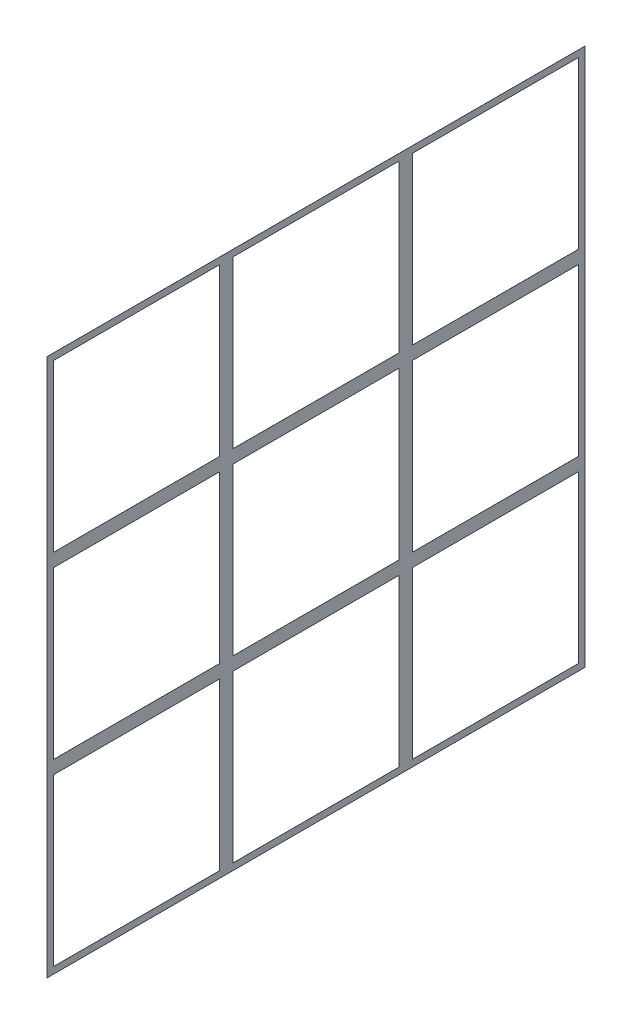
from build123d import *

# Parameters (mm, degrees)
SKETCH_1_W      = 1620
SKETCH_1_H      = 1620
SKETCH_1_W_2    = 500
SKETCH_1_H_2    = 500
EXTRUDE_1_DEPTH = 0.1


with BuildPart() as part:
    # 草图1 → 凸台-拉伸1 (new body)
    with BuildSketch(Plane(origin=(0, 0, 0), x_dir=(0, 0, -1), z_dir=(1, 0, 0))):
        Rectangle(SKETCH_1_W, SKETCH_1_H)
        with Locations((-540, 540)):
            Rectangle(SKETCH_1_W_2, SKETCH_1_H_2, mode=Mode.SUBTRACT)
        with Locations((0, 540)):
            Rectangle(SKETCH_1_W_2, SKETCH_1_H_2, mode=Mode.SUBTRACT)
        with Locations((540, 540)):
            Rectangle(SKETCH_1_W_2, SKETCH_1_H_2, mode=Mode.SUBTRACT)
        with Locations((540, 0)):
            Rectangle(SKETCH_1_W_2, SKETCH_1_H_2, mode=Mode.SUBTRACT)
        Rectangle(SKETCH_1_W_2, SKETCH_1_H_2, mode=Mode.SUBTRACT)
        with Locations((-540, 0)):
            Rectangle(SKETCH_1_W_2, SKETCH_1_H_2, mode=Mode.SUBTRACT)
        with Locations((-540, -540)):
            Rectangle(SKETCH_1_W_2, SKETCH_1_H_2, mode=Mode.SUBTRACT)
        with Locations((0, -540)):
            Rectangle(SKETCH_1_W_2, SKETCH_1_H_2, mode=Mode.SUBTRACT)
        with Locations((540, -540)):
            Rectangle(SKETCH_1_W_2, SKETCH_1_H_2, mode=Mode.SUBTRACT)
    extrude(amount=EXTRUDE_1_DEPTH)


solid = part.part
